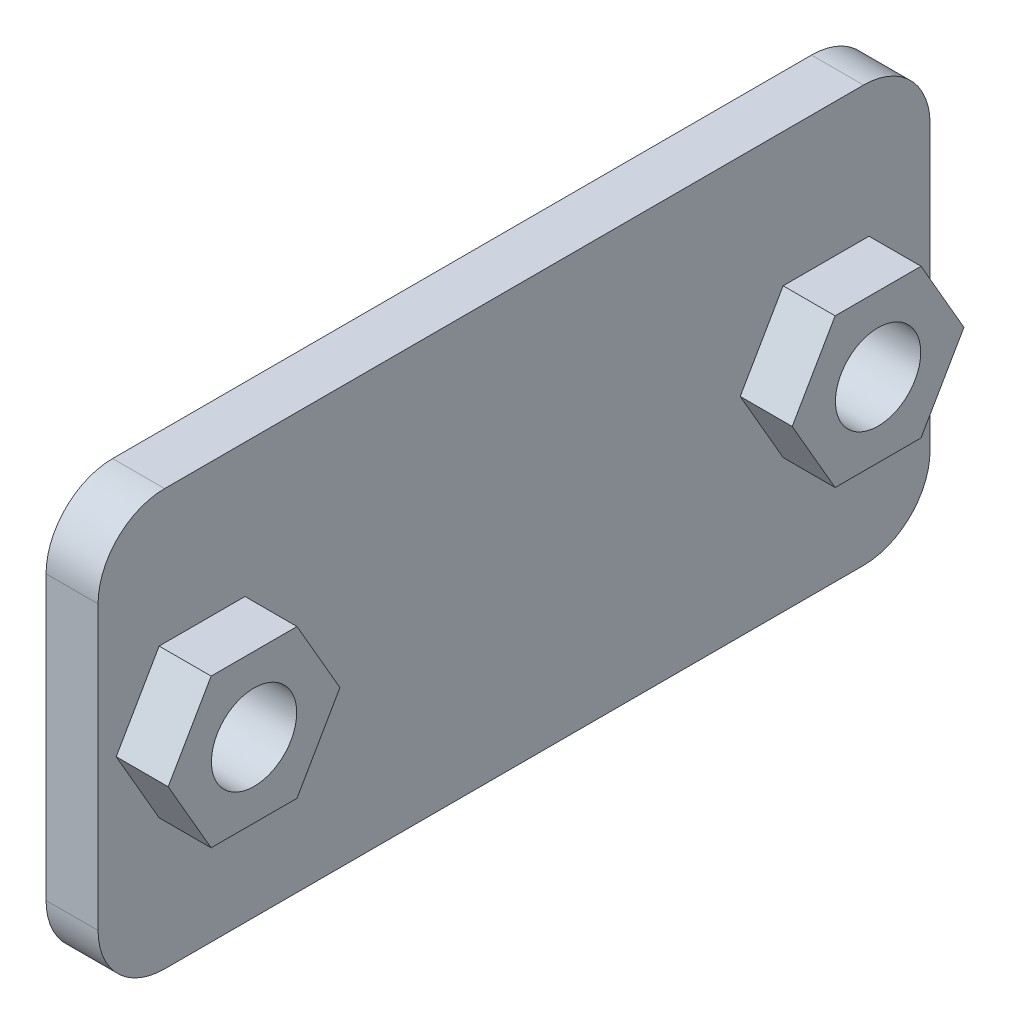
from build123d import *

# Parameters (mm, degrees)
SZKIC2_W                    = 80
SZKIC2_H                    = 40
DODANIE_WYCI_GNI_CIE1_DEPTH = 5
ZAOKR_GLENIE1_R             = 6.4
SZKIC3_R                    = 4.1
WYTNIJ_WYCI_GNI_CIE1_DEPTH  = 10
DODANIE_WYCI_GNI_CIE2_DEPTH = 5
WYTNIJ_WYCI_GNI_CIE2_START  = -15
SZKIC5_R                    = 4.1
WYTNIJ_WYCI_GNI_CIE2_DEPTH  = 15


with BuildPart() as part:
    # Szkic2 → Dodanie-wyciągnięcie1 (new body)
    with BuildSketch(Plane(origin=(0, 0, 0), x_dir=(0, 0, -1), z_dir=(1, 0, 0))):
        Rectangle(SZKIC2_W, SZKIC2_H)
    extrude(amount=DODANIE_WYCI_GNI_CIE1_DEPTH)

    # Zaokrąglenie1
    zaokr_glenie1_edges = [part.edges().sort_by_distance(p)[0] for p in [
        (2.5, -20, -40),
        (2.5, -20, 40),
        (2.5, 20, 40),
        (2.5, 20, -40),
    ]]
    fillet(zaokr_glenie1_edges, radius=ZAOKR_GLENIE1_R)

    # Szkic3 → Wytnij-wyciągnięcie1 (cut, symmetric)
    with BuildSketch(Plane(origin=(5, 0, 0), x_dir=(0, 0, -1), z_dir=(1, 0, 0))):
        with Locations((-30, 0)):
            Circle(SZKIC3_R)
        with Locations((30, 0)):
            Circle(SZKIC3_R)
    extrude(amount=WYTNIJ_WYCI_GNI_CIE1_DEPTH, both=True, mode=Mode.SUBTRACT)

    # Szkic4 → Dodanie-wyciągnięcie2 (add)
    with BuildSketch(Plane(origin=(5, 0, 0), x_dir=(0, 0, -1), z_dir=(1, 0, 0))):
        Polygon((-21.743891151, 0), (-25.871945575, 7.15), (-34.128054425, 7.15), (-38.256108849, 0), (-34.128054425, -7.15), (-25.871945575, -7.15), align=None)
        Polygon((21.743891151, 0), (25.871945575, -7.15), (34.128054425, -7.15), (38.256108849, 0), (34.128054425, 7.15), (25.871945575, 7.15), align=None)
    extrude(amount=DODANIE_WYCI_GNI_CIE2_DEPTH)

    # Szkic5 → Wytnij-wyciągnięcie2 (cut)
    with BuildSketch(Plane.ZY.offset(WYTNIJ_WYCI_GNI_CIE2_START)):
        with Locations(Location((30, 0, 0), (0, 0, 180))):
            Circle(SZKIC5_R)
        with Locations(Location((-30, 0, 0), (0, 0, 180))):
            Circle(SZKIC5_R)
    extrude(amount=WYTNIJ_WYCI_GNI_CIE2_DEPTH, mode=Mode.SUBTRACT)


solid = part.part
